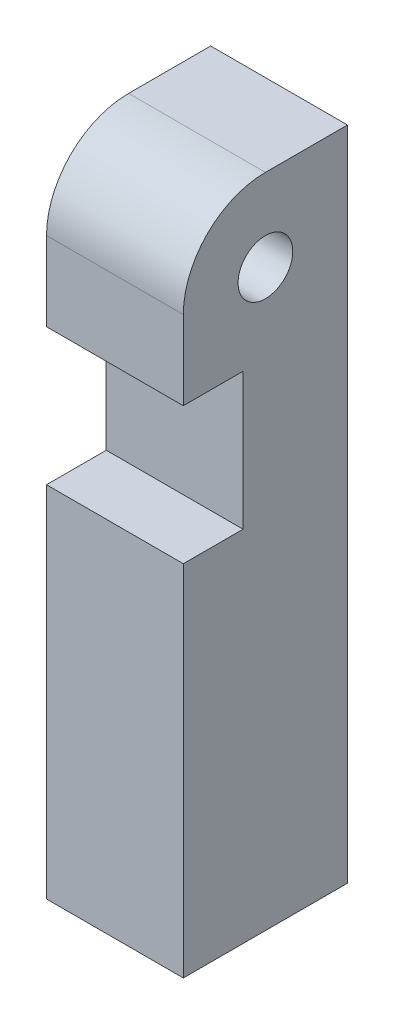
from build123d import *

# Parameters (mm, degrees)
ELEVATOR_PADDLE_R   = 1.27
BOSS_EXTRUDE1_DEPTH = 6.35


with BuildPart() as part:
    # Elevator Paddle → Boss-Extrude1 (new body)
    with BuildSketch(Plane(origin=(0, 0, 0), x_dir=(0, 0, -1), z_dir=(1, 0, 0))):
        with BuildLine():
            Line((3.81, 3.81), (3.81, -26.67))
            Line((3.81, -26.67), (-3.81, -26.67))
            Line((-3.81, -26.67), (-3.81, -10.0160188))
            Line((-3.81, -10.0160188), (-1.037499957, -10.0160188))
            Line((-1.037499957, -10.0160188), (-1.037499957, -3.6660188))
            Line((-1.037499957, -3.6660188), (-3.81, -3.6660188))
            Line((-3.81, -3.6660188), (-3.81, 0))
            ThreePointArc((-3.81, 0), (-2.694076836, 2.694076836), (0, 3.81))
            Line((0, 3.81), (3.81, 3.81))
        make_face()
        Circle(ELEVATOR_PADDLE_R, mode=Mode.SUBTRACT)
    extrude(amount=BOSS_EXTRUDE1_DEPTH)


solid = part.part
